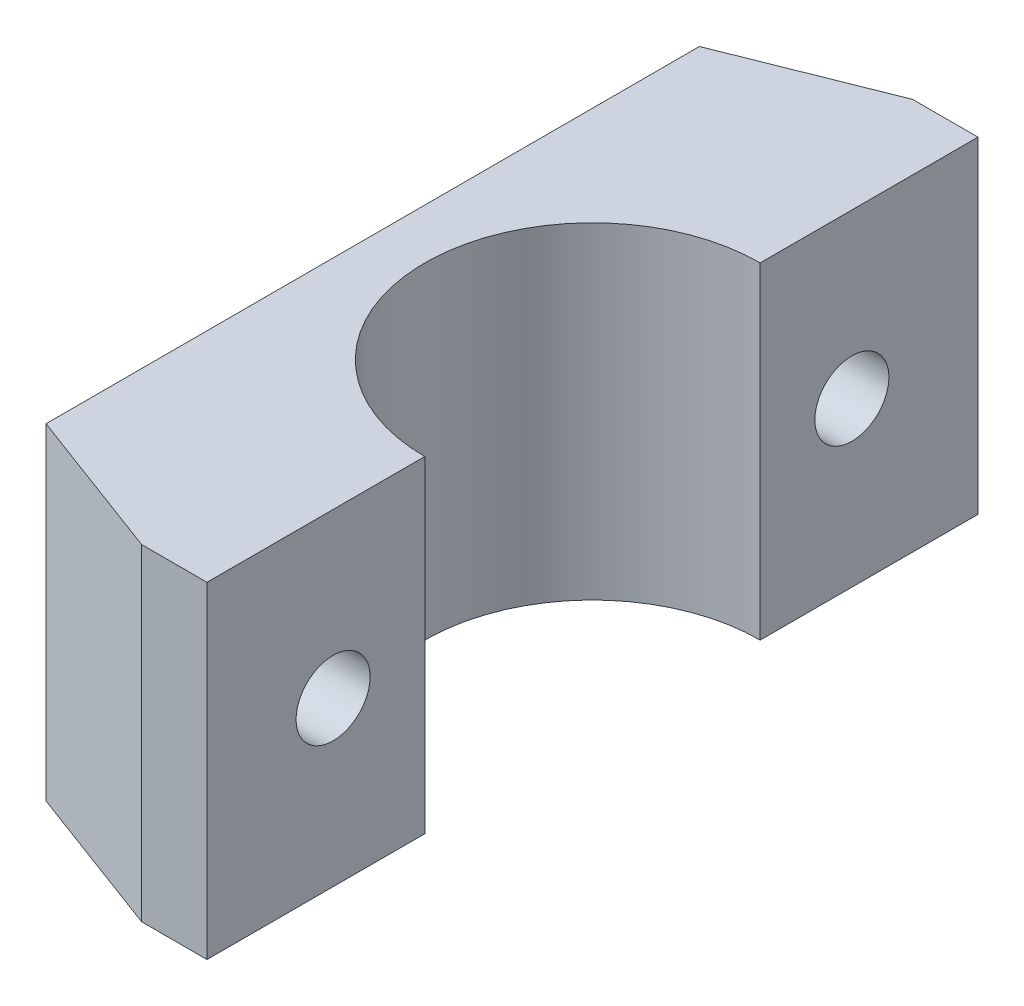
from build123d import *

# Parameters (mm, degrees)
BOSS_EXTRUDE1_DEPTH = 15
SKETCH2_R           = 1.7
CUT_EXTRUDE1_DEPTH  = 15


with BuildPart() as part:
    # Sketch1 → Boss-Extrude1 (new body)
    with BuildSketch(Plane(origin=(0, 0, 0), x_dir=(1, 0, 0), z_dir=(0, 1, 0))):
        with BuildLine():
            Line((0, 7.7), (0, 17.7))
            Line((0, 17.7), (-3, 17.7))
            Line((-3, 17.7), (-10, 14.909160565))
            Line((-10, 14.909160565), (-10, -15.090839435))
            Line((-10, -15.090839435), (-3, -17.7))
            Line((-3, -17.7), (0, -17.7))
            Line((0, -17.7), (0, -7.7))
            ThreePointArc((0, -7.7), (-7.7, 0), (0, 7.7))
        make_face()
    extrude(amount=BOSS_EXTRUDE1_DEPTH)

    # Sketch2 → Cut-Extrude1 (cut)
    with BuildSketch(Plane.ZY.offset(10)):
        with Locations((-11.909160565, 7.5)):
            Circle(SKETCH2_R)
        with Locations((11.909160565, 7.5)):
            Circle(SKETCH2_R)
    extrude(amount=-CUT_EXTRUDE1_DEPTH, mode=Mode.SUBTRACT)


solid = part.part
